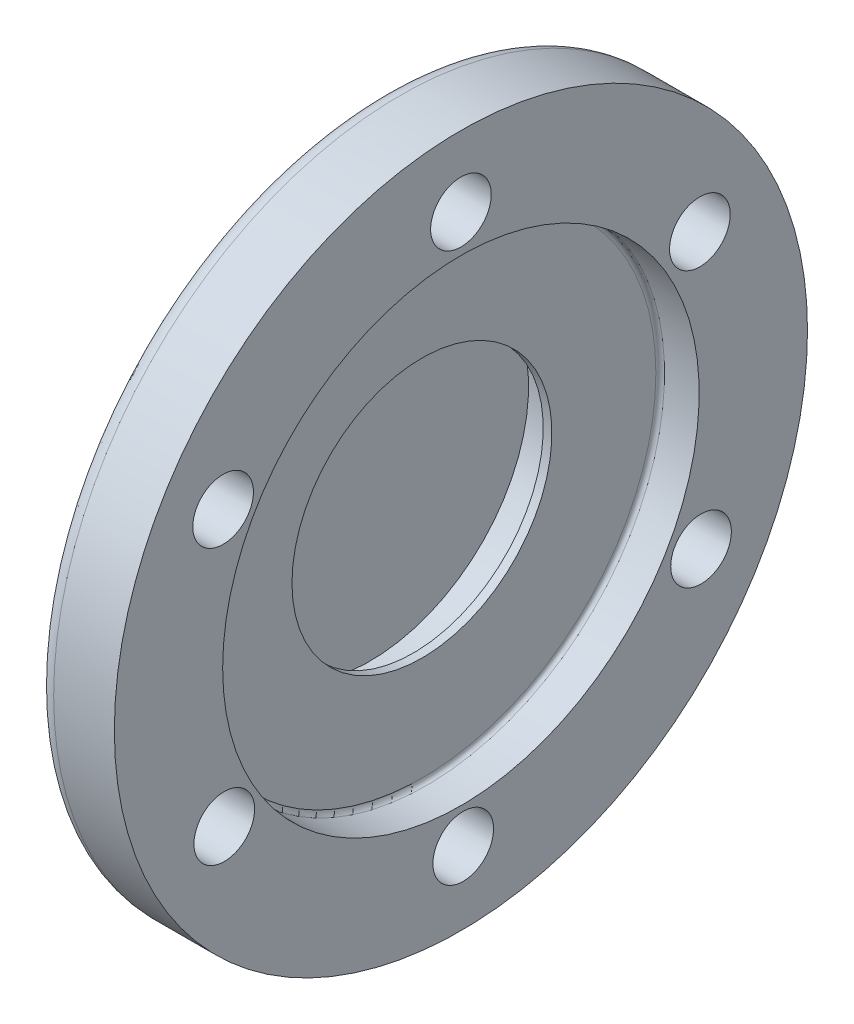
from build123d import *

# Parameters (mm, degrees)
SKETCH2_W              = 14.003667681
SKETCH2_H              = 20
M16X2_0_TAPPED_HOLE1_D = 14
FILLET4_R              = 4
FILLET5_R              = 1


with BuildPart() as part:
    # Sketch1 → Revolve1 (revolve)
    with BuildSketch(Plane(origin=(0, 0, 0), x_dir=(1, 0, 0), z_dir=(0, 1, 0)), mode=Mode.PRIVATE) as revolve1_sk:
        with BuildLine():
            Line((-3.251971734, 30), (-1.251971734, 30))
            Line((-1.251971734, 30), (-1.251971734, 55))
            Line((-1.251971734, 55), (7.748028266, 55))
            Line((7.748028266, 55), (7.748028266, 60))
            Line((7.748028266, 60), (-6.255639415, 60))
            Line((-6.255639415, 60), (-6.255639415, 80))
            Line((-6.255639415, 80), (-10.255639415, 80))
            Line((-10.255639415, 80), (-10.255639415, 48))
            ThreePointArc((-10.255639415, 48), (-11.134319072, 45.878679656), (-13.255639415, 45))
            Line((-13.255639415, 45), (-18.165214358, 45))
            Line((-18.165214358, 45), (-18.165214358, 0))
            Line((-18.165214358, 0), (-13.255639415, 0))
            Line((-13.255639415, 0), (-13.255639415, 36.618791205))
            Line((-13.255639415, 36.618791205), (-3.251971734, 36.618791205))
            Line((-3.251971734, 36.618791205), (-3.251971734, 30))
        make_face()
    revolve(revolve1_sk.sketch.rotate(Axis((0, 0, 0), (1, 0, 0)), 180), axis=Axis((0, 0, 0), (1, 0, 0)))

    # Sketch2 → Revolve2 (revolve)
    with BuildSketch(Plane(origin=(0, 0, 0), x_dir=(1, 0, 0), z_dir=(0, 1, 0)), mode=Mode.PRIVATE) as revolve2_sk:
        with Locations((0.746194426, 70)):
            Rectangle(SKETCH2_W, SKETCH2_H)
    revolve(revolve2_sk.sketch.rotate(Axis((0, 0, 0), (-1, 0, 0)), 180), axis=Axis((0, 0, 0), (-1, 0, 0)))

    # M16x2.0 Tapped Hole1 (through all)
    with Locations(Plane.ZY.offset(10.255639415)):
        with Locations((0, 63.690604398), (54.889736939, 31.690604398), (54.621792488, -31.845302199), (-0.535888903, -63.381208795), (-55.425625842, -31.381208795), (-55.157681391, 32.154697801)):
            Hole(M16X2_0_TAPPED_HOLE1_D / 2)

    # Fillet4
    fillet4_edges = [part.edges().sort_by_distance(p)[0] for p in [
        (-10.255639415, 0, -80),
    ]]
    fillet(fillet4_edges, radius=FILLET4_R)

    # Fillet5
    fillet5_edges = [part.edges().sort_by_distance(p)[0] for p in [
        (-1.251971734, 0, -55),
    ]]
    fillet(fillet5_edges, radius=FILLET5_R)


solid = part.part
